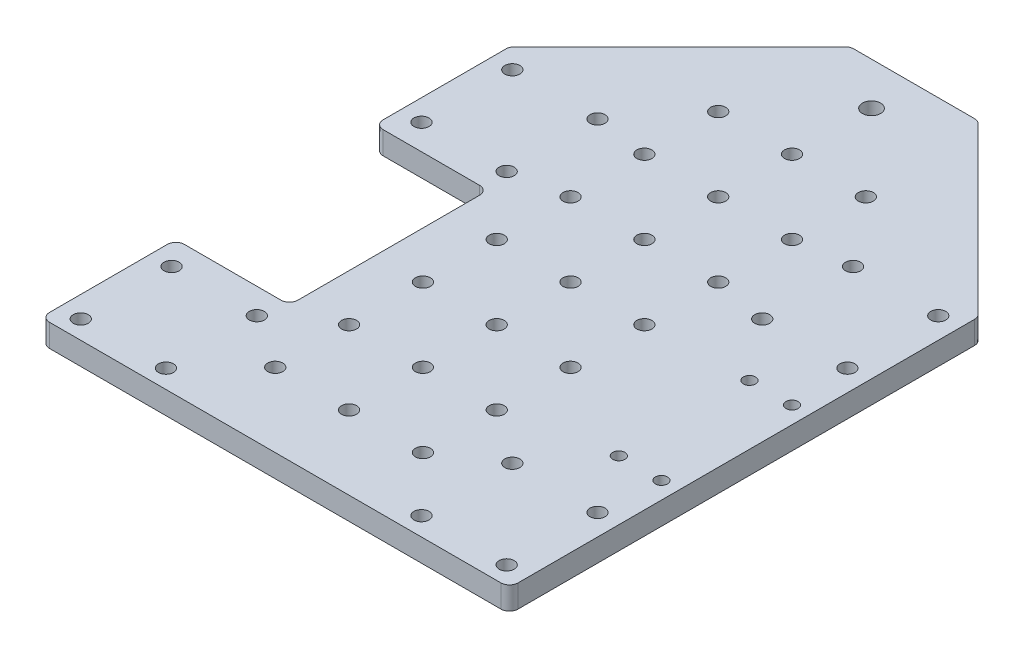
from build123d import *

# Parameters (mm, degrees)
SKETCH1_W                = 165
SKETCH1_H                = 225
BOSS_EXTRUDE1_DEPTH      = 8
SKETCH2_W                = 40
SKETCH2_H                = 70
CUT_EXTRUDE1_DEPTH       = 280.130793715
CHAMFER1_SIZE            = 60
M6_CLEARANCE_HOLE1_D     = 6.4
M6_CLEARANCE_HOLE1_DEPTH = 8
M6_CLEARANCE_HOLE1_TIP   = 1.922753981
M5_CLEARANCE_HOLE1_D     = 5.3
M5_CLEARANCE_HOLE1_DEPTH = 8
M5_CLEARANCE_HOLE1_TIP   = 1.59228064
M5_CLEARANCE_HOLE2_D     = 5.3
M5_CLEARANCE_HOLE2_DEPTH = 8
M5_CLEARANCE_HOLE2_TIP   = 1.59228064
FILLET1_R                = 3
M4_CLEARANCE_HOLE1_D     = 4.3
M4_CLEARANCE_HOLE1_DEPTH = 8
M4_CLEARANCE_HOLE1_TIP   = 1.291850331


with BuildPart() as part:
    # Sketch1 → Boss-Extrude1 (new body)
    with BuildSketch(Plane(origin=(0, 0, 0), x_dir=(1, 0, 0), z_dir=(0, 1, 0))):
        with Locations((82.5, 112.5)):
            Rectangle(SKETCH1_W, SKETCH1_H)
    extrude(amount=BOSS_EXTRUDE1_DEPTH)

    # Sketch2 → Cut-Extrude1 (cut, through all)
    with BuildSketch(Plane.XZ):
        with Locations((20, -82.5)):
            Rectangle(SKETCH2_W, SKETCH2_H)
    extrude(amount=-CUT_EXTRUDE1_DEPTH, mode=Mode.SUBTRACT)

    # Chamfer1
    chamfer1_edges = [part.edges().sort_by_distance(p)[0] for p in [
        (165, 4, -225),
        (0, 4, -225),
    ]]
    chamfer(chamfer1_edges, length=CHAMFER1_SIZE)

    # M6 Clearance Hole1
    with Locations(Plane(origin=(0, 8, 0), x_dir=(1, 0, 0), z_dir=(0, 1, 0))):
        with Locations((82.5, 210)):
            Hole(M6_CLEARANCE_HOLE1_D / 2, depth=M6_CLEARANCE_HOLE1_DEPTH)
            with Locations((0, 0, -(M6_CLEARANCE_HOLE1_DEPTH + M6_CLEARANCE_HOLE1_TIP / 2))):  # 118° drill point
                Cone(0, M6_CLEARANCE_HOLE1_D / 2, M6_CLEARANCE_HOLE1_TIP, mode=Mode.SUBTRACT)

    # M5 Clearance Hole1
    with Locations(Plane(origin=(0, 8, 0), x_dir=(1, 0, 0), z_dir=(0, 1, 0))):
        with Locations((7.5, 158.5), (37.5, 158.5), (37.5, 126.5), (7.5, 126.5), (157.5, 126.5), (127.5, 126.5), (127.5, 158.5), (157.5, 158.5), (157.5, 6.5), (127.5, 6.5), (127.5, 38.5), (157.5, 38.5), (7.5, 38.5), (37.5, 38.5), (37.5, 6.5), (7.5, 6.5)):
            Hole(M5_CLEARANCE_HOLE1_D / 2, depth=M5_CLEARANCE_HOLE1_DEPTH)
            with Locations((0, 0, -(M5_CLEARANCE_HOLE1_DEPTH + M5_CLEARANCE_HOLE1_TIP / 2))):  # 118° drill point
                Cone(0, M5_CLEARANCE_HOLE1_D / 2, M5_CLEARANCE_HOLE1_TIP, mode=Mode.SUBTRACT)

    # M5 Clearance Hole2
    with Locations(Plane(origin=(0, 8, 0), x_dir=(1, 0, 0), z_dir=(0, 1, 0))):
        with Locations((56.5, 26), (82.5, 26), (108.5, 26), (82.5, 52), (108.5, 52), (82.5, 78), (108.5, 78), (82.5, 104), (108.5, 104), (82.5, 130), (108.5, 130), (82.5, 156), (108.5, 156), (82.5, 182), (108.5, 182), (56.5, 52), (56.5, 78), (56.5, 104), (56.5, 130), (56.5, 156), (56.5, 182)):
            Hole(M5_CLEARANCE_HOLE2_D / 2, depth=M5_CLEARANCE_HOLE2_DEPTH)
            with Locations((0, 0, -(M5_CLEARANCE_HOLE2_DEPTH + M5_CLEARANCE_HOLE2_TIP / 2))):  # 118° drill point
                Cone(0, M5_CLEARANCE_HOLE2_D / 2, M5_CLEARANCE_HOLE2_TIP, mode=Mode.SUBTRACT)

    # Fillet1
    fillet1_edges = [part.edges().sort_by_distance(p)[0] for p in [
        (60, 4, -225),
        (105, 4, -225),
        (165, 4, -165),
        (165, 4, 0),
        (0, 4, 0),
        (0, 4, -47.5),
        (40, 4, -47.5),
        (40, 4, -117.5),
        (0, 4, -117.5),
        (0, 4, -165),
    ]]
    fillet(fillet1_edges, radius=FILLET1_R)

    # M4 Clearance Hole1
    with Locations(Plane(origin=(0, 8, 0), x_dir=(1, 0, 0), z_dir=(0, 1, 0))):
        with Locations((144, 105.5), (159, 105.5), (159, 59.5), (144, 59.5)):
            Hole(M4_CLEARANCE_HOLE1_D / 2, depth=M4_CLEARANCE_HOLE1_DEPTH)
            with Locations((0, 0, -(M4_CLEARANCE_HOLE1_DEPTH + M4_CLEARANCE_HOLE1_TIP / 2))):  # 118° drill point
                Cone(0, M4_CLEARANCE_HOLE1_D / 2, M4_CLEARANCE_HOLE1_TIP, mode=Mode.SUBTRACT)


solid = part.part
